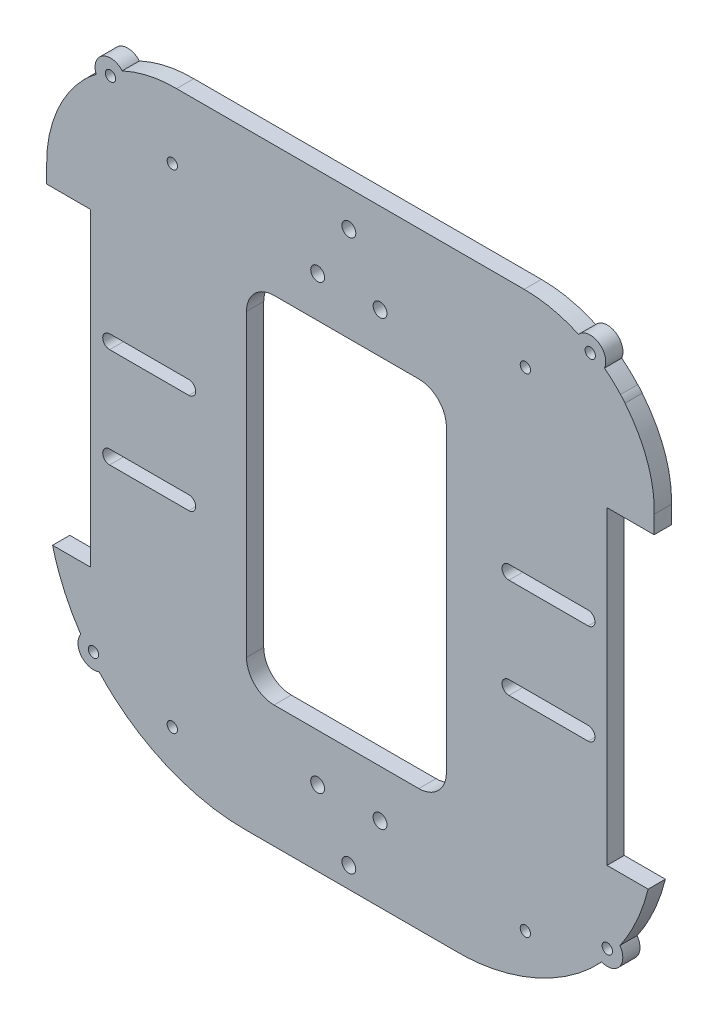
from build123d import *

# Parameters (mm, degrees)
SKETCH1_R           = 2.01
SKETCH1_R_2         = 1.5
BOSS_EXTRUDE1_DEPTH = 5
SKETCH3_R           = 1.502108832
SKETCH3_R_2         = 1.5
CUT_EXTRUDE1_DEPTH  = 5
SKETCH6_R           = 127.388909146
CUT_EXTRUDE2_DEPTH  = 10
SKETCH7_R           = 1.5
CUT_EXTRUDE3_DEPTH  = 10
BOSS_EXTRUDE2_START = -5
SKETCH8_R           = 1.502108832
BOSS_EXTRUDE2_DEPTH = 5


with BuildPart() as part:
    # Sketch1 → Boss-Extrude1 (new body)
    with BuildSketch(Plane.XY):
        with BuildLine():
            Line((75.504557328, -44.459304845), (75.504557328, 45.540695166))
            Line((75.504557328, 45.540695166), (100.059689798, 45.540695166))
            add(Edge.make_bspline(
                [(100.059689798, 45.540695166), (100.041788228, 45.754261833), (99.850008352, 47.893495098), (98.96868948, 53.830439174), (96.130771714, 63.067301471), (90.671016468, 73.277711787), (83.341127235, 82.262457854), (74.36610438, 89.593910485), (64.164774078, 95.050161964), (54.928289046, 97.885319352), (47.287800195, 99.020154484), (43.400368962, 99.191158918), (41.462449937, 99.172959613)],
                knots=[0.055788601, 0.055788601, 0.055788601, 0.055788601, 0.062711167, 0.125182898, 0.250126359, 0.375069821, 0.500013282, 0.624956744, 0.749900205, 0.874843667, 0.937315398, 0.999787128, 0.999787128, 0.999787128, 0.999787128], degree=3))
            Line((41.462449937, 99.172959613), (-37.993292469, 99.172959613))
            add(Edge.make_bspline(
                [(-37.993292469, 99.172959613), (-41.828390734, 99.192174166), (-49.528051244, 98.435603453), (-60.581226949, 95.081607626), (-70.808859789, 89.670474861), (-79.808884098, 82.300210471), (-87.147846669, 73.275518481), (-92.643550681, 63.029136296), (-95.563376916, 53.601119233), (-96.412693125, 47.662538368), (-96.590112943, 45.540695166)],
                knots=[0.000114592, 0.000114592, 0.000114592, 0.000114592, 0.125060228, 0.250005865, 0.374951502, 0.499897139, 0.624842775, 0.749788412, 0.874734049, 0.943757473, 0.943757473, 0.943757473, 0.943757473], degree=3))
            Line((-96.590112943, 45.540695166), (-74.495442672, 45.540695166))
            Line((-74.495442672, 45.540695166), (-74.495442672, -44.459304845))
            Line((-74.495442672, -44.459304845), (-96.069812767, -44.459304845))
            Line((-96.069812767, -44.459304845), (-96.069812767, -58.94108417))
            add(Edge.make_bspline(
                [(-96.069812767, -58.94108417), (-96.103597655, -60.242783602), (-96.020757858, -62.86424422), (-95.284873318, -67.958362235), (-93.368947654, -74.058002404), (-89.696192927, -80.728467677), (-84.849845597, -86.58500717), (-79.007758993, -91.452906948), (-72.33795175, -95.146253023), (-66.222611962, -97.071224016), (-61.106429471, -97.805589863), (-58.468563645, -97.88419966), (-57.159547687, -97.847472391)],
                knots=[0.000901993, 0.000901993, 0.000901993, 0.000901993, 0.063285077, 0.12566816, 0.250434328, 0.375200496, 0.499966664, 0.624732831, 0.749498999, 0.874265167, 0.936648251, 0.999031335, 0.999031335, 0.999031335, 0.999031335], degree=3))
            Line((-57.159547687, -97.847472391), (62.058252081, -97.847472391))
            add(Edge.make_bspline(
                [(62.058252081, -97.847472391), (63.349284352, -97.87302538), (65.946474819, -97.778812963), (71.006373371, -97.039227825), (77.079986888, -95.147057025), (83.747716292, -91.525384678), (89.621452499, -86.731070085), (94.516764786, -80.923365419), (98.236814692, -74.255649702), (100.174956425, -68.105115813), (100.911947701, -62.938495931), (100.98924539, -60.262367482), (100.951464077, -58.935920146)],
                knots=[0.000693468, 0.000693468, 0.000693468, 0.000693468, 0.063089705, 0.125485942, 0.250278415, 0.375070889, 0.499863363, 0.624655837, 0.749448311, 0.874240785, 0.936637021, 0.999033258, 0.999033258, 0.999033258, 0.999033258], degree=3))
            Line((100.951464077, -58.935920146), (100.951464077, -44.459304845))
            Line((100.951464077, -44.459304845), (75.504557328, -44.459304845))
        make_face()
        with Locations((0.504557328, -81.923550041)):
            Circle(SKETCH1_R, mode=Mode.SUBTRACT)
        with Locations((-8.560442672, -66.22250947)):
            Circle(SKETCH1_R, mode=Mode.SUBTRACT)
        with Locations((9.569557328, -66.22250947)):
            Circle(SKETCH1_R, mode=Mode.SUBTRACT)
        with Locations(Location((9.569557328, 62.375409388, 0), (0, 0, 180))):
            Circle(SKETCH1_R, mode=Mode.SUBTRACT)
        with Locations(Location((-8.560442672, 62.375409388, 0), (0, 0, 180))):
            Circle(SKETCH1_R, mode=Mode.SUBTRACT)
        with Locations(Location((0.504557328, 78.076449959, 0), (0, 0, 180))):
            Circle(SKETCH1_R, mode=Mode.SUBTRACT)
        with Locations((51.787679438, 68.968213223)):
            Circle(SKETCH1_R_2, mode=Mode.SUBTRACT)
        with Locations(Location((-50.778564782, 68.968213223, 0), (0, 0, 180))):
            Circle(SKETCH1_R_2, mode=Mode.SUBTRACT)
        with Locations((-50.778564782, -72.815313305)):
            Circle(SKETCH1_R_2, mode=Mode.SUBTRACT)
        with Locations(Location((51.787679438, -72.815313305, 0), (0, 0, 180))):
            Circle(SKETCH1_R_2, mode=Mode.SUBTRACT)
        with BuildLine():
            Line((20.835255983, 50.556927645), (-21.225305639, 50.556927645))
            ThreePointArc((-21.225305639, 50.556927645), (-26.882159889, 48.213781894), (-29.225305639, 42.556927645))
            Line((-29.225305639, 42.556927645), (-29.225305639, -44.475522072))
            ThreePointArc((-29.225305639, -44.475522072), (-26.882159889, -50.132376322), (-21.225305639, -52.475522072))
            Line((-21.225305639, -52.475522072), (20.835255983, -52.475522072))
            ThreePointArc((20.835255983, -52.475522072), (26.492110233, -50.132376322), (28.835255983, -44.475522072))
            Line((28.835255983, -44.475522072), (28.835255983, 42.556927645))
            ThreePointArc((28.835255983, 42.556927645), (26.492110233, 48.213781894), (20.835255983, 50.556927645))
        make_face(mode=Mode.SUBTRACT)
        with BuildLine():
            Line((47.004557328, -15.95930484), (70.004557328, -15.95930484))
            ThreePointArc((70.004557328, -15.95930484), (72.004557328, -13.95930484), (70.004557328, -11.95930484))
            Line((70.004557328, -11.95930484), (47.004557328, -11.95930484))
            ThreePointArc((47.004557328, -11.95930484), (45.004557328, -13.95930484), (47.004557328, -15.95930484))
        make_face(mode=Mode.SUBTRACT)
        with BuildLine():
            Line((-45.995442672, -15.95930484), (-68.995442672, -15.95930484))
            ThreePointArc((-68.995442672, -15.95930484), (-70.995442672, -13.95930484), (-68.995442672, -11.95930484))
            Line((-68.995442672, -11.95930484), (-45.995442672, -11.95930484))
            ThreePointArc((-45.995442672, -11.95930484), (-43.995442672, -13.95930484), (-45.995442672, -15.95930484))
        make_face(mode=Mode.SUBTRACT)
        with BuildLine():
            Line((-45.995442672, 13.04069516), (-68.995442672, 13.04069516))
            ThreePointArc((-68.995442672, 13.04069516), (-70.995442672, 15.04069516), (-68.995442672, 17.04069516))
            Line((-68.995442672, 17.04069516), (-45.995442672, 17.04069516))
            ThreePointArc((-45.995442672, 17.04069516), (-43.995442672, 15.04069516), (-45.995442672, 13.04069516))
        make_face(mode=Mode.SUBTRACT)
        with BuildLine():
            Line((47.004557328, 13.04069516), (70.004557328, 13.04069516))
            ThreePointArc((70.004557328, 13.04069516), (72.004557328, 15.04069516), (70.004557328, 17.04069516))
            Line((70.004557328, 17.04069516), (47.004557328, 17.04069516))
            ThreePointArc((47.004557328, 17.04069516), (45.004557328, 15.04069516), (47.004557328, 13.04069516))
        make_face(mode=Mode.SUBTRACT)
    extrude(amount=BOSS_EXTRUDE1_DEPTH)

    # Sketch3 → Cut-Extrude1 (cut)
    with BuildSketch(Plane(origin=(-67.725712149, -284.067502755, 0), x_dir=(0, -1, 0), z_dir=(0, 0, -1))):
        with Locations(Location((-358.51234805, 8.035243007, 0), (0, 0, 90))):
            Circle(SKETCH3_R)
        with Locations(Location((-358.51234805, -146.964756993, 0), (0, 0, 90))):
            Circle(SKETCH3_R)
        with Locations(Location((-198.51234805, -146.964756993, 0), (0, 0, 90))):
            Circle(SKETCH3_R_2)
        with Locations(Location((-198.51234805, 8.035243007, 0), (0, 0, 90))):
            Circle(SKETCH3_R_2)
    extrude(amount=-CUT_EXTRUDE1_DEPTH, mode=Mode.SUBTRACT)

    # Sketch6 → Cut-Extrude2 (cut)
    with BuildSketch(Plane.XY.offset(5)):
        Circle(SKETCH6_R)
        with BuildLine():
            Line((-87.277351018, -30.425691892), (-87.277351018, 50.698917047))
            add(Edge.make_bspline(
                [(-87.277351018, 50.698917047), (-87.345293709, 62.092554876), (-81.91852953, 73.408536042), (-72.908806653, 80.366097079)],
                knots=[0, 0, 0, 0, 1, 1, 1, 1], degree=3))
            ThreePointArc((-72.908806653, 80.366097079), (-71.074769912, 85.869026234), (-65.340831928, 84.992741324))
            add(Edge.make_bspline(
                [(-65.340831928, 84.992741324), (-57.788055604, 88.493717217), (-49.542903418, 88.433129599)],
                knots=[0, 0, 0, 1, 1, 1], degree=2))
            Line((-49.542903418, 88.433129599), (51.441442769, 88.433129599))
            add(Edge.make_bspline(
                [(51.441442769, 88.433129599), (59.678483611, 88.437151289), (67.233362352, 84.98585913)],
                knots=[0, 0, 0, 1, 1, 1], degree=2))
            ThreePointArc((67.233362352, 84.98585913), (73.005560597, 85.849122489), (74.775204798, 80.287481041))
            add(Edge.make_bspline(
                [(74.775204798, 80.287481041), (83.589006393, 73.308525296), (89.668786675, 62.097481339), (89.175890368, 50.698917047)],
                knots=[0, 0, 0, 0, 1, 1, 1, 1], degree=3))
            Line((89.175890368, 50.698917047), (89.175890368, -30.425691892))
            add(Edge.make_bspline(
                [(89.175890368, -30.425691892), (89.178293605, -41.855069867), (85.762409509, -53.342513531), (79.252897634, -62.750515348)],
                knots=[0, 0, 0, 0, 1, 1, 1, 1], degree=3))
            ThreePointArc((79.252897634, -62.750515348), (79.128857618, -68.135420529), (73.929922922, -69.543847935))
            add(Edge.make_bspline(
                [(73.929922922, -69.543847935), (69.434477623, -74.486167285), (56.518819164, -84.02444032), (40.807367453, -88.132321569), (31.581207186, -88.020016316)],
                knots=[0, 0, 0, 0, 0.421407571, 1, 1, 1, 1], degree=3))
            Line((31.581207186, -88.020016316), (-29.682667836, -88.020016316))
            add(Edge.make_bspline(
                [(-29.682667836, -88.020016316), (-45.510843982, -88.093323652), (-61.333296445, -81.273069841), (-72.030941971, -69.543673037)],
                knots=[0, 0, 0, 0, 1, 1, 1, 1], degree=3))
            ThreePointArc((-72.030941971, -69.543673037), (-77.21426967, -68.155781128), (-77.38390991, -62.7925403))
            add(Edge.make_bspline(
                [(-77.38390991, -62.7925403), (-83.813349424, -53.321823673), (-87.323146284, -41.875751549), (-87.277351018, -30.425691892)],
                knots=[0, 0, 0, 0, 1, 1, 1, 1], degree=3))
        make_face(mode=Mode.SUBTRACT)
    extrude(amount=-CUT_EXTRUDE2_DEPTH, mode=Mode.SUBTRACT)

    # Sketch7 → Cut-Extrude3 (cut)
    with BuildSketch(Plane.XY.offset(5)):
        with Locations((75.586718904, -65.359946995)):
            Circle(SKETCH7_R)
        with Locations((-73.688179554, -65.359946995)):
            Circle(SKETCH7_R)
        with Locations((70.626130167, 82.029657757)):
            Circle(SKETCH7_R)
        with Locations((-68.727590817, 82.029657757)):
            Circle(SKETCH7_R)
    extrude(amount=-CUT_EXTRUDE3_DEPTH, mode=Mode.SUBTRACT)

    # Sketch8 → Boss-Extrude2 (add)
    with BuildSketch(Plane.XY.offset(5).offset(BOSS_EXTRUDE2_START)):
        with Locations((-75.760955156, 74.444845294)):
            Circle(SKETCH8_R)
        with BuildLine():
            ThreePointArc((79.425475108, 75.935340078), (78.101855611, 73.463452615), (80.740777557, 74.41123274))
            add(Edge.make_bspline(
                [(80.740777557, 74.41123274), (80.204403355, 75.278133212), (79.425475108, 75.935340078)],
                knots=[0, 0, 0, 1, 1, 1], degree=2))
        make_face()
    extrude(amount=BOSS_EXTRUDE2_DEPTH)


solid = part.part
